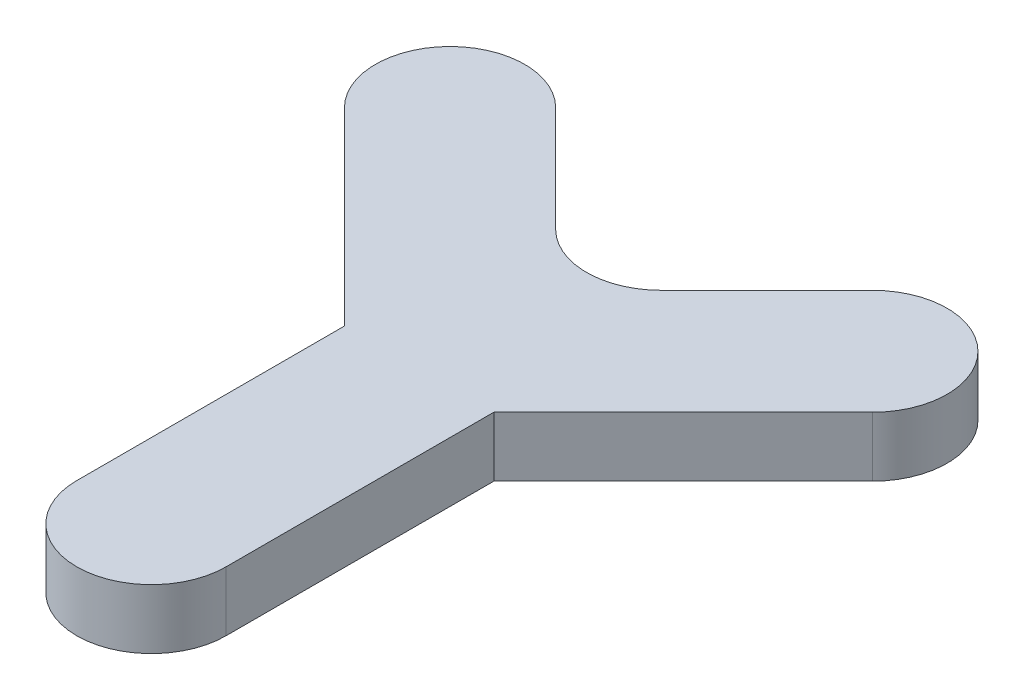
from build123d import *

# Parameters (mm, degrees)
BOSS_EXTRUDE1_DEPTH = 2


with BuildPart() as part:
    # Sketch1 → Boss-Extrude1 (new body)
    with BuildSketch(Plane(origin=(0, 0, 0), x_dir=(1, 0, 0), z_dir=(0, 1, 0))):
        with BuildLine():
            Line((2.5, -10), (2.5, -1.035533906))
            Line((2.5, -1.035533906), (8.838834765, 5.303300859))
            ThreePointArc((8.838834765, 5.303300859), (8.838834765, 8.838834765), (5.303300859, 8.838834765))
            Line((5.303300859, 8.838834765), (1.767766953, 5.303300859))
            ThreePointArc((1.767766953, 5.303300859), (0, 4.571067812), (-1.767766953, 5.303300859))
            Line((-1.767766953, 5.303300859), (-5.303300859, 8.838834765))
            ThreePointArc((-5.303300859, 8.838834765), (-8.838834765, 8.838834765), (-8.838834765, 5.303300859))
            Line((-8.838834765, 5.303300859), (-2.5, -1.035533906))
            Line((-2.5, -1.035533906), (-2.5, -10))
            ThreePointArc((-2.5, -10), (0, -12.5), (2.5, -10))
        make_face()
    extrude(amount=BOSS_EXTRUDE1_DEPTH)


solid = part.part
